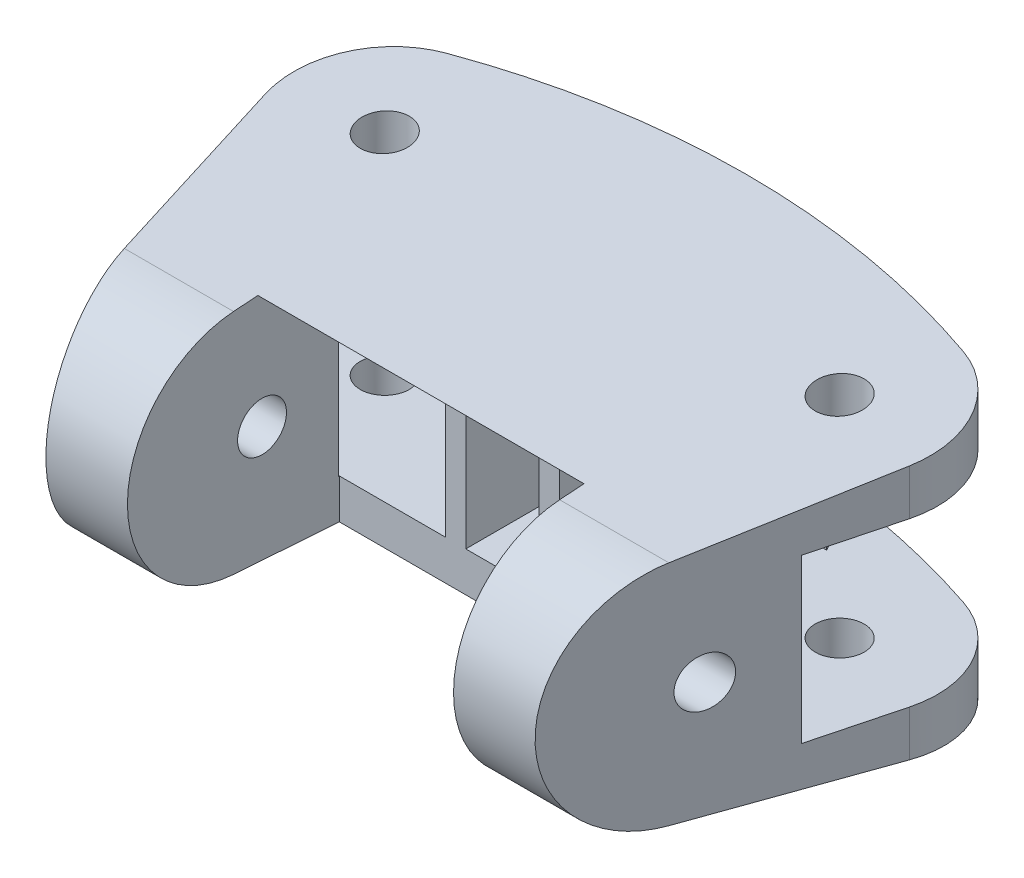
from build123d import *

# Parameters (mm, degrees)
SKETCH1_R          = 1.5
EXTRUDE1_DEPTH     = 8.5
SKETCH2_R          = 1.5
CUT_EXTRUDE1_DEPTH = 25
CUT_EXTRUDE2_DEPTH = 10
CUT_EXTRUDE3_DEPTH = 5


with BuildPart() as part:
    # Sketch1 → Extrude1 (new, symmetric)
    with BuildSketch(Plane(origin=(0, 0, 0), x_dir=(1, 0, 0), z_dir=(0, 1, 0))):
        with BuildLine():
            Line((-15, 0), (15, 0))
            Line((15, 0), (19.755405538, 18.21438149))
            ThreePointArc((19.755405538, 18.21438149), (19.225810264, 22.587646069), (15.852272727, 25.420517177))
            ThreePointArc((15.852272727, 25.420517177), (0, 28), (-15.852272727, 25.420517177))
            ThreePointArc((-15.852272727, 25.420517177), (-19.225810264, 22.587646069), (-19.755405538, 18.21438149))
            Line((-19.755405538, 18.21438149), (-15, 0))
        make_face()
        with Locations((-13.95, 19.730055116)):
            Circle(SKETCH1_R, mode=Mode.SUBTRACT)
        with Locations((13.95, 19.730055116)):
            Circle(SKETCH1_R, mode=Mode.SUBTRACT)
    extrude(amount=EXTRUDE1_DEPTH, both=True)

    # Sketch2 → Cut-Extrude1 (cut, symmetric)
    with BuildSketch(Plane(origin=(0, 0, 0), x_dir=(0, 0, -1), z_dir=(1, 0, 0))):
        with Locations((8.255055116, 0)):
            Circle(SKETCH2_R)
        with BuildLine():
            Line((6.507034671, 6.982620223), (29, 8.570598903))
            Line((29, 8.570598903), (29, 9.570598903))
            Line((29, 9.570598903), (-1, 9.570598903))
            Line((-1, 9.570598903), (-1, -9.570598903))
            Line((-1, -9.570598903), (29, -9.570598903))
            Line((29, -9.570598903), (29, -8.570598903))
            Line((29, -8.570598903), (6.507034671, -6.982620223))
            ThreePointArc((6.507034671, -6.982620223), (0, 0), (6.507034671, 6.982620223))
        make_face()
    extrude(amount=CUT_EXTRUDE1_DEPTH, both=True, mode=Mode.SUBTRACT)

    # Sketch4 → Cut-Extrude2 (cut, symmetric)
    with BuildSketch(Plane(origin=(0, 0, 0), x_dir=(0, 0, -1), z_dir=(1, 0, 0))):
        Polygon((-2, -8.5), (13, -8.5), (13, 5), (10.488407646, 5), (5.125516479, 9.5), (-2, 9.5), align=None)
    extrude(amount=CUT_EXTRUDE2_DEPTH, both=True, mode=Mode.SUBTRACT)

    # Sketch7 → Cut-Extrude3 (cut, symmetric)
    with BuildSketch(Plane(origin=(0, 0, 0), x_dir=(1, 0, 0), z_dir=(0, 1, 0))):
        Polygon((-10, 6.507034671), (-10, 12.951116752), (-21.755405538, 12.951116752), (-21.755405538, 29), (-6, 29), (-8.886751346, 24), (-3.5, 24), (-3.5, 8), (-2.25, 8), (-2.25, 24), (2.25, 24), (2.25, 8), (3.5, 8), (3.5, 24), (8.886751346, 24), (6, 29), (21.755405538, 29), (21.755405538, 12.951116752), (10, 12.951116752), (10, 6.507034671), align=None)
    extrude(amount=CUT_EXTRUDE3_DEPTH, both=True, mode=Mode.SUBTRACT)


solid = part.part
